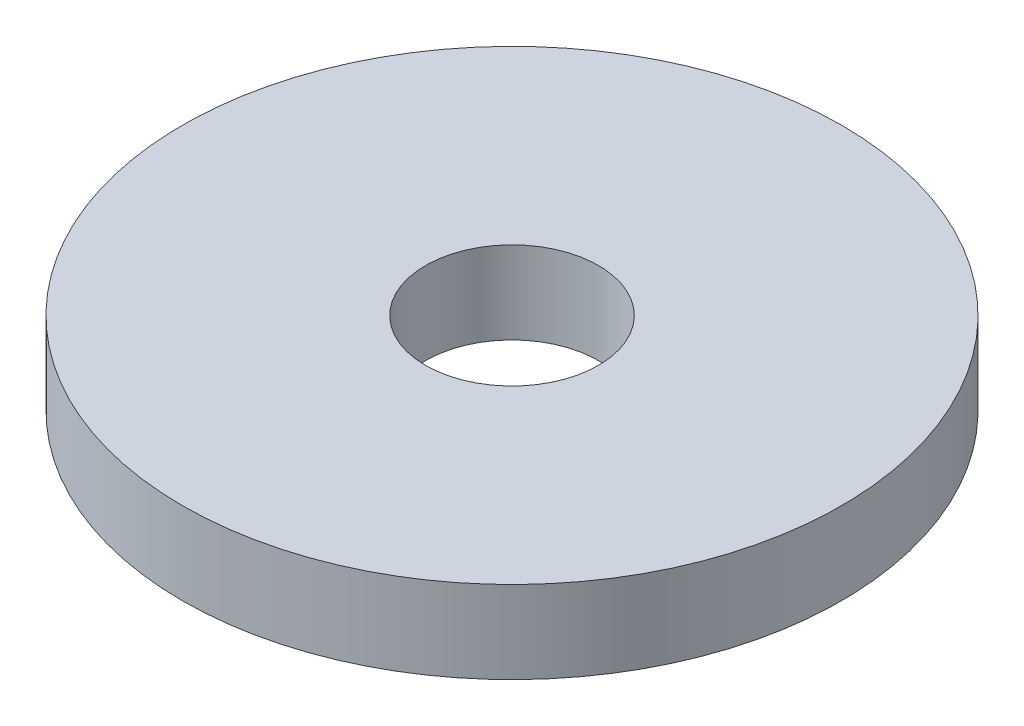
from build123d import *

# Parameters (mm, degrees)
SKETCH1_R           = 8
SKETCH1_R_2         = 2.1
BOSS_EXTRUDE1_DEPTH = 2


with BuildPart() as part:
    # Sketch1 → Boss-Extrude1 (new body)
    with BuildSketch(Plane(origin=(0, 0, 0), x_dir=(1, 0, 0), z_dir=(0, 1, 0))):
        with Locations(Location((0, 0, 0), (0, 0, 270))):
            Circle(SKETCH1_R)
        with Locations(Location((0, 0, 0), (0, 0, 270))):
            Circle(SKETCH1_R_2, mode=Mode.SUBTRACT)
    extrude(amount=BOSS_EXTRUDE1_DEPTH)


solid = part.part
